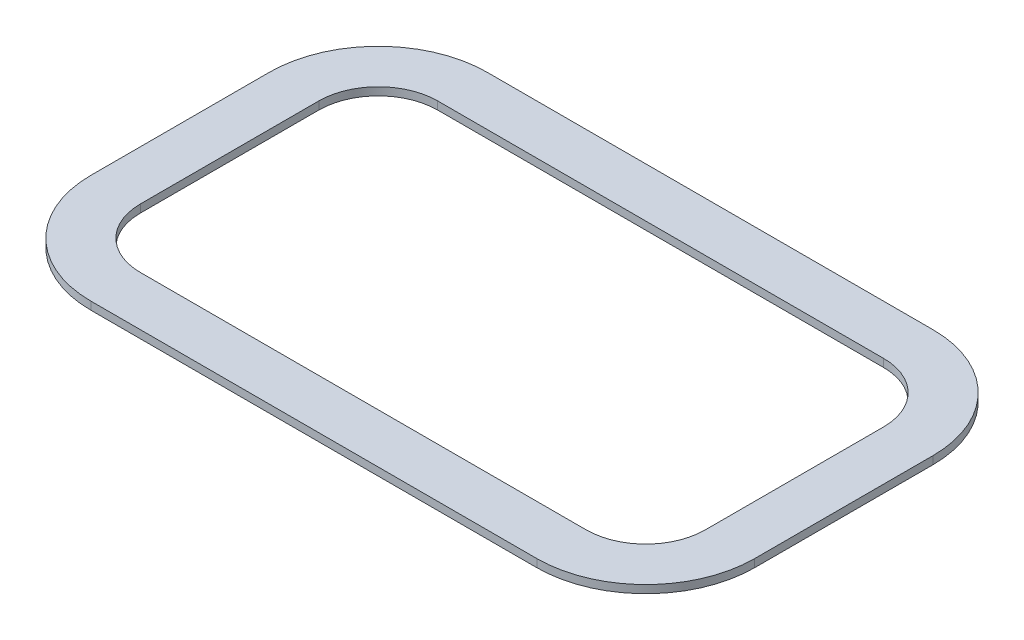
from build123d import *

# Parameters (mm, degrees)
BOSS_EXTRUDE1_DEPTH = 4


with BuildPart() as part:
    # Sketch1 → Boss-Extrude1 (new body)
    with BuildSketch(Plane(origin=(0, 0, 0), x_dir=(1, 0, 0), z_dir=(0, 1, 0))):
        with BuildLine():
            Line((55, 0), (280, 0))
            ThreePointArc((280, 0), (318.890872965, 16.109127035), (335, 55))
            Line((335, 55), (335, 145))
            ThreePointArc((335, 145), (318.890872965, 183.890872965), (280, 200))
            Line((280, 200), (55, 200))
            ThreePointArc((55, 200), (16.109127035, 183.890872965), (0, 145))
            Line((0, 145), (0, 55))
            ThreePointArc((0, 55), (16.109127035, 16.109127035), (55, 0))
        make_face()
        with BuildLine():
            Line((55, 25), (280, 25))
            ThreePointArc((280, 25), (301.213203436, 33.786796564), (310, 55))
            Line((310, 55), (310, 145))
            ThreePointArc((310, 145), (301.213203436, 166.213203436), (280, 175))
            Line((280, 175), (55, 175))
            ThreePointArc((55, 175), (33.786796564, 166.213203436), (25, 145))
            Line((25, 145), (25, 55))
            ThreePointArc((25, 55), (33.786796564, 33.786796564), (55, 25))
        make_face(mode=Mode.SUBTRACT)
    extrude(amount=BOSS_EXTRUDE1_DEPTH)


solid = part.part
